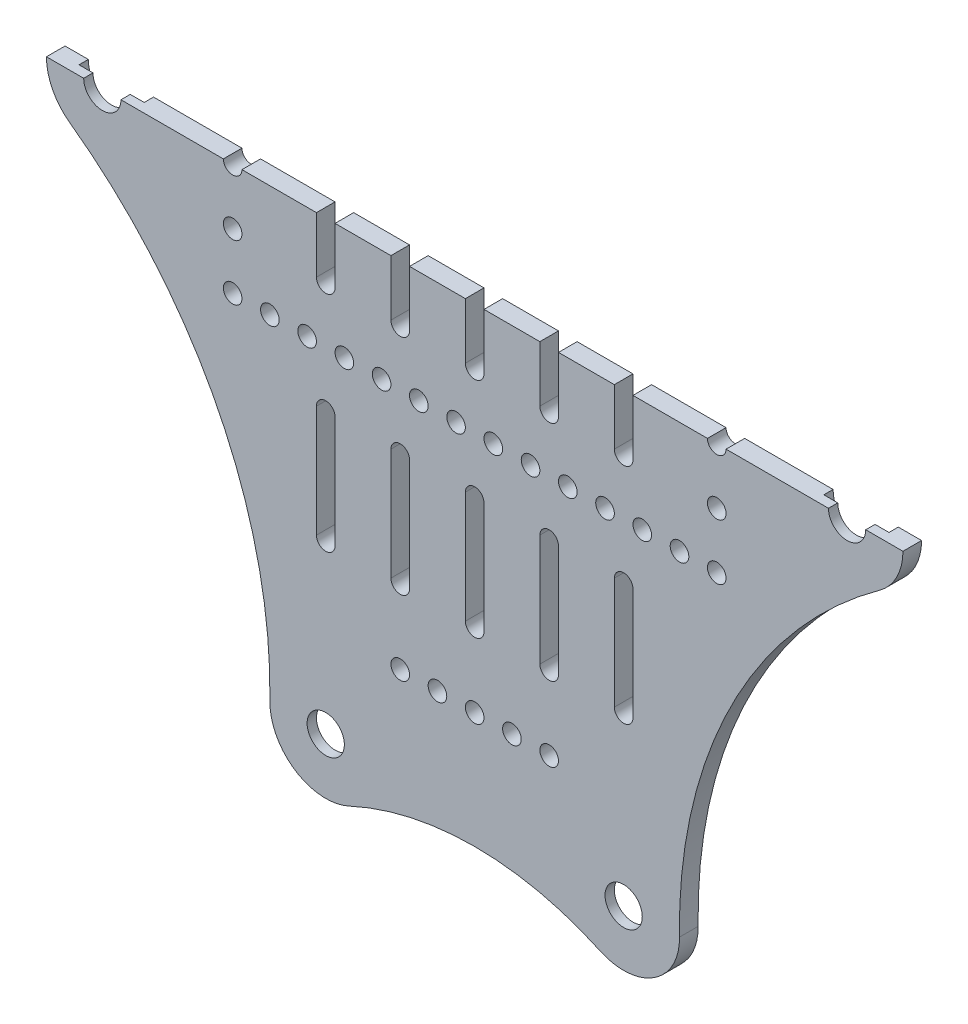
from build123d import *

# Parameters (mm, degrees)
BOSS_EXTRUDE1_DEPTH = 5
SKETCH2_R           = 5
CUT_EXTRUDE1_DEPTH  = 178.411949992
SKETCH5_R           = 2.5
CUT_EXTRUDE4_DEPTH  = 12.5
CUT_EXTRUDE5_DEPTH  = 10
SKETCH7_R           = 2.5
CUT_EXTRUDE6_DEPTH  = 10
SKETCH8_R           = 2.5
CUT_EXTRUDE7_DEPTH  = 10
SKETCH9_R           = 8.75
CUT_EXTRUDE8_DEPTH  = 2.5
SKETCH10_W          = 230
SKETCH10_H          = 135
CUT_EXTRUDE9_DEPTH  = 10


with BuildPart() as part:
    # Sketch1 → Boss-Extrude1 (new body)
    with BuildSketch(Plane.XY):
        with BuildLine():
            ThreePointArc((108.79085436, -12.15404787), (115, 0), (108.79085436, 12.15404787))
            ThreePointArc((108.79085436, 12.15404787), (68.702723984, 59.351361992), (54.997750912, 119.740254766))
            ThreePointArc((54.997750912, 119.740254766), (48.179588548, 132.573556823), (33.684210526, 133.60554311))
            ThreePointArc((33.684210526, 133.60554311), (0, 126.168439698), (-33.684210526, 133.60554311))
            ThreePointArc((-33.684210526, 133.60554311), (-48.179588548, 132.573556823), (-54.997750912, 119.740254766))
            ThreePointArc((-54.997750912, 119.740254766), (-68.702723984, 59.351361992), (-108.79085436, 12.15404787))
            ThreePointArc((-108.79085436, 12.15404787), (-115, 0), (-108.79085436, -12.15404787))
            ThreePointArc((-108.79085436, -12.15404787), (-68.702723984, -59.351361992), (-54.997750912, -119.740254766))
            ThreePointArc((-54.997750912, -119.740254766), (-48.179588548, -132.573556823), (-33.684210526, -133.60554311))
            ThreePointArc((-33.684210526, -133.60554311), (0, -126.168439698), (33.684210526, -133.60554311))
            ThreePointArc((33.684210526, -133.60554311), (48.179588548, -132.573556823), (54.997750912, -119.740254766))
            ThreePointArc((54.997750912, -119.740254766), (68.702723984, -59.351361992), (108.79085436, -12.15404787))
        make_face()
    extrude(amount=BOSS_EXTRUDE1_DEPTH)

    # Sketch2 → Cut-Extrude1 (cut, through all)
    with BuildSketch(Plane(origin=(0, 0, 0), x_dir=(-1, 0, 0), z_dir=(0, 0, -1))):
        with Locations((-40, 120)):
            Circle(SKETCH2_R)
        with Locations((-100, 0)):
            Circle(SKETCH2_R)
        with Locations(Location((100, 0, 0), (0, 0, 180))):
            Circle(SKETCH2_R)
        with Locations(Location((40, 120, 0), (0, 0, 180))):
            Circle(SKETCH2_R)
        with Locations((40, -120)):
            Circle(SKETCH2_R)
        with Locations(Location((-40, -120, 0), (0, 0, 180))):
            Circle(SKETCH2_R)
    extrude(amount=-CUT_EXTRUDE1_DEPTH, mode=Mode.SUBTRACT)

    # Sketch5 → Cut-Extrude4 (cut)
    with BuildSketch(Plane(origin=(0, 0, 0), x_dir=(-1, 0, 0), z_dir=(0, 0, -1))):
        with Locations((20, 95)):
            Circle(SKETCH5_R)
        with Locations((0, 95)):
            Circle(SKETCH5_R)
        with Locations((10, 95)):
            Circle(SKETCH5_R)
        with Locations(Location((10, -95, 0), (0, 0, 180))):
            Circle(SKETCH5_R)
        with Locations(Location((0, -95, 0), (0, 0, 180))):
            Circle(SKETCH5_R)
        with Locations(Location((20, -95, 0), (0, 0, 180))):
            Circle(SKETCH5_R)
        with Locations(Location((-20, 95, 0), (0, 0, 180))):
            Circle(SKETCH5_R)
        with Locations(Location((-10, 95, 0), (0, 0, 180))):
            Circle(SKETCH5_R)
        with Locations((-20, -95)):
            Circle(SKETCH5_R)
        with Locations((-10, -95)):
            Circle(SKETCH5_R)
    extrude(amount=-CUT_EXTRUDE4_DEPTH, mode=Mode.SUBTRACT)

    # Sketch6 → Cut-Extrude5 (cut)
    with BuildSketch(Plane.XY.offset(5)):
        with BuildLine():
            Line((42.5, 75), (42.5, 45))
            ThreePointArc((42.5, 45), (40, 42.5), (37.5, 45))
            Line((37.5, 45), (37.5, 75))
            ThreePointArc((37.5, 75), (40, 77.5), (42.5, 75))
        make_face()
        with BuildLine():
            Line((22.5, 75), (22.5, 45))
            ThreePointArc((22.5, 45), (20, 42.5), (17.5, 45))
            Line((17.5, 45), (17.5, 75))
            ThreePointArc((17.5, 75), (20, 77.5), (22.5, 75))
        make_face()
        with BuildLine():
            Line((2.5, 75), (2.5, 45))
            ThreePointArc((2.5, 45), (0, 42.5), (-2.5, 45))
            Line((-2.5, 45), (-2.5, 75))
            ThreePointArc((-2.5, 75), (0, 77.5), (2.5, 75))
        make_face()
        with BuildLine():
            Line((-17.5, 75), (-17.5, 45))
            ThreePointArc((-17.5, 45), (-20, 42.5), (-22.5, 45))
            Line((-22.5, 45), (-22.5, 75))
            ThreePointArc((-22.5, 75), (-20, 77.5), (-17.5, 75))
        make_face()
        with BuildLine():
            Line((-37.5, 75), (-37.5, 45))
            ThreePointArc((-37.5, 45), (-40, 42.5), (-42.5, 45))
            Line((-42.5, 45), (-42.5, 75))
            ThreePointArc((-42.5, 75), (-40, 77.5), (-37.5, 75))
        make_face()
        with BuildLine():
            Line((42.5, 15), (42.5, -15))
            ThreePointArc((42.5, -15), (40, -17.5), (37.5, -15))
            Line((37.5, -15), (37.5, 15))
            ThreePointArc((37.5, 15), (40, 17.5), (42.5, 15))
        make_face()
        with BuildLine():
            Line((22.5, 15), (22.5, -15))
            ThreePointArc((22.5, -15), (20, -17.5), (17.5, -15))
            Line((17.5, -15), (17.5, 15))
            ThreePointArc((17.5, 15), (20, 17.5), (22.5, 15))
        make_face()
        with BuildLine():
            Line((2.5, 15), (2.5, -15))
            ThreePointArc((2.5, -15), (0, -17.5), (-2.5, -15))
            Line((-2.5, -15), (-2.5, 15))
            ThreePointArc((-2.5, 15), (0, 17.5), (2.5, 15))
        make_face()
        with BuildLine():
            Line((-17.5, 15), (-17.5, -15))
            ThreePointArc((-17.5, -15), (-20, -17.5), (-22.5, -15))
            Line((-22.5, -15), (-22.5, 15))
            ThreePointArc((-22.5, 15), (-20, 17.5), (-17.5, 15))
        make_face()
        with BuildLine():
            Line((-37.5, 15), (-37.5, -15))
            ThreePointArc((-37.5, -15), (-40, -17.5), (-42.5, -15))
            Line((-42.5, -15), (-42.5, 15))
            ThreePointArc((-42.5, 15), (-40, 17.5), (-37.5, 15))
        make_face()
        with BuildLine():
            Line((42.5, -45), (42.5, -75))
            ThreePointArc((42.5, -75), (40, -77.5), (37.5, -75))
            Line((37.5, -75), (37.5, -45))
            ThreePointArc((37.5, -45), (40, -42.5), (42.5, -45))
        make_face()
        with BuildLine():
            Line((22.5, -45), (22.5, -75))
            ThreePointArc((22.5, -75), (20, -77.5), (17.5, -75))
            Line((17.5, -75), (17.5, -45))
            ThreePointArc((17.5, -45), (20, -42.5), (22.5, -45))
        make_face()
        with BuildLine():
            Line((2.5, -45), (2.5, -75))
            ThreePointArc((2.5, -75), (0, -77.5), (-2.5, -75))
            Line((-2.5, -75), (-2.5, -45))
            ThreePointArc((-2.5, -45), (0, -42.5), (2.5, -45))
        make_face()
        with BuildLine():
            Line((-17.5, -45), (-17.5, -75))
            ThreePointArc((-17.5, -75), (-20, -77.5), (-22.5, -75))
            Line((-22.5, -75), (-22.5, -45))
            ThreePointArc((-22.5, -45), (-20, -42.5), (-17.5, -45))
        make_face()
        with BuildLine():
            Line((-37.5, -45), (-37.5, -75))
            ThreePointArc((-37.5, -75), (-40, -77.5), (-42.5, -75))
            Line((-42.5, -75), (-42.5, -45))
            ThreePointArc((-42.5, -45), (-40, -42.5), (-37.5, -45))
        make_face()
    extrude(amount=-CUT_EXTRUDE5_DEPTH, mode=Mode.SUBTRACT)

    # Sketch7 → Cut-Extrude6 (cut)
    with BuildSketch(Plane.XY.offset(5)):
        with Locations((-65, 30)):
            Circle(SKETCH7_R)
        with Locations((-55, 30)):
            Circle(SKETCH7_R)
        with Locations((-45, 30)):
            Circle(SKETCH7_R)
        with Locations((-35, 30)):
            Circle(SKETCH7_R)
        with Locations((-25, 30)):
            Circle(SKETCH7_R)
        with Locations((-15, 30)):
            Circle(SKETCH7_R)
        with Locations((-5, 30)):
            Circle(SKETCH7_R)
        with Locations((5, 30)):
            Circle(SKETCH7_R)
        with Locations((15, 30)):
            Circle(SKETCH7_R)
        with Locations((25, 30)):
            Circle(SKETCH7_R)
        with Locations((35, 30)):
            Circle(SKETCH7_R)
        with Locations((45, 30)):
            Circle(SKETCH7_R)
        with Locations((55, 30)):
            Circle(SKETCH7_R)
        with Locations((65, 30)):
            Circle(SKETCH7_R)
        with Locations((65, -30)):
            Circle(SKETCH7_R)
        with Locations((55, -30)):
            Circle(SKETCH7_R)
        with Locations((45, -30)):
            Circle(SKETCH7_R)
        with Locations((35, -30)):
            Circle(SKETCH7_R)
        with Locations((25, -30)):
            Circle(SKETCH7_R)
        with Locations((15, -30)):
            Circle(SKETCH7_R)
        with Locations((5, -30)):
            Circle(SKETCH7_R)
        with Locations((-5, -30)):
            Circle(SKETCH7_R)
        with Locations((-15, -30)):
            Circle(SKETCH7_R)
        with Locations((-25, -30)):
            Circle(SKETCH7_R)
        with Locations((-35, -30)):
            Circle(SKETCH7_R)
        with Locations((-45, -30)):
            Circle(SKETCH7_R)
        with Locations((-55, -30)):
            Circle(SKETCH7_R)
        with Locations((-65, -30)):
            Circle(SKETCH7_R)
    extrude(amount=-CUT_EXTRUDE6_DEPTH, mode=Mode.SUBTRACT)

    # Sketch8 → Cut-Extrude7 (cut)
    with BuildSketch(Plane.XY.offset(5)):
        with Locations((-65, 0)):
            Circle(SKETCH8_R)
        with Locations((-65, 15)):
            Circle(SKETCH8_R)
        with Locations((-65, -15)):
            Circle(SKETCH8_R)
        with Locations((65, -15)):
            Circle(SKETCH8_R)
        with Locations((65, 0)):
            Circle(SKETCH8_R)
        with Locations((65, 15)):
            Circle(SKETCH8_R)
    extrude(amount=-CUT_EXTRUDE7_DEPTH, mode=Mode.SUBTRACT)

    # Sketch9 → Cut-Extrude8 (cut)
    with BuildSketch(Plane(origin=(0, 0, 0), x_dir=(-1, 0, 0), z_dir=(0, 0, -1))):
        with Locations((100, 0)):
            Circle(SKETCH9_R)
        with Locations((40, 120)):
            Circle(SKETCH9_R)
        with Locations((40, -120)):
            Circle(SKETCH9_R)
        with Locations((-40, -120)):
            Circle(SKETCH9_R)
        with Locations((-100, 0)):
            Circle(SKETCH9_R)
        with Locations((-40, 120)):
            Circle(SKETCH9_R)
    extrude(amount=-CUT_EXTRUDE8_DEPTH, mode=Mode.SUBTRACT)

    # Sketch10 → Cut-Extrude9 (cut)
    with BuildSketch(Plane.XY.offset(5)):
        with Locations((0, 67.5)):
            Rectangle(SKETCH10_W, SKETCH10_H)
    extrude(amount=-CUT_EXTRUDE9_DEPTH, mode=Mode.SUBTRACT)


solid = part.part
